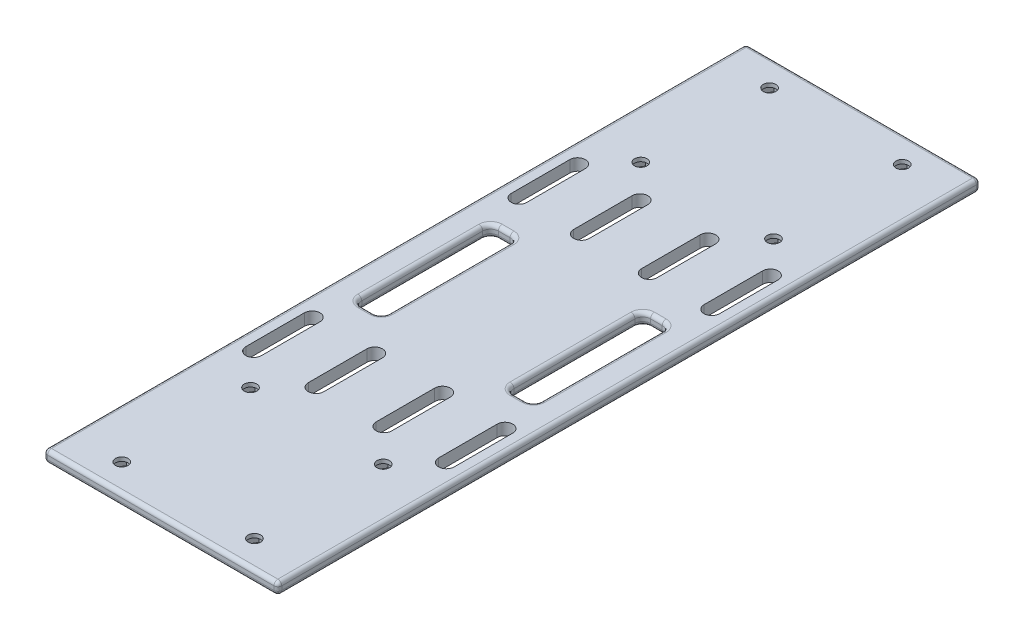
from build123d import *

# Parameters (mm, degrees)
SKETCH1_W           = 60
SKETCH1_H           = 180
SKETCH1_R           = 1.6
BOSS_EXTRUDE1_DEPTH = 3
CUT_EXTRUDE1_DEPTH  = 72
FILLET2_R           = 1
SKETCH3_R           = 1
CUT_EXTRUDE2_DEPTH  = 1
SKETCH4_R           = 1.6
CUT_EXTRUDE3_DEPTH  = 2
FILLET3_R           = 1
FILLET4_R           = 1
CUT_EXTRUDE4_DEPTH  = 10


with BuildPart() as part:
    # Sketch1 → Boss-Extrude1 (new body)
    with BuildSketch(Plane(origin=(0, 0, 0), x_dir=(1, 0, 0), z_dir=(0, 1, 0))):
        Rectangle(SKETCH1_W, SKETCH1_H)
        with Locations(Location((-17, 83, 0), (0, 0, 270))):
            Circle(SKETCH1_R, mode=Mode.SUBTRACT)
        with Locations(Location((-17, 50, 0), (0, 0, 270))):
            Circle(SKETCH1_R, mode=Mode.SUBTRACT)
        with Locations(Location((17, 50, 0), (0, 0, 90))):
            Circle(SKETCH1_R, mode=Mode.SUBTRACT)
        with Locations(Location((17, 83, 0), (0, 0, 90))):
            Circle(SKETCH1_R, mode=Mode.SUBTRACT)
        with Locations(Location((-17, -50, 0), (0, 0, 90))):
            Circle(SKETCH1_R, mode=Mode.SUBTRACT)
        with Locations(Location((17, -50, 0), (0, 0, 270))):
            Circle(SKETCH1_R, mode=Mode.SUBTRACT)
        with Locations(Location((17, -83, 0), (0, 0, 270))):
            Circle(SKETCH1_R, mode=Mode.SUBTRACT)
        with Locations(Location((-17, -83, 0), (0, 0, 90))):
            Circle(SKETCH1_R, mode=Mode.SUBTRACT)
    extrude(amount=BOSS_EXTRUDE1_DEPTH)

    # Sketch2 → Cut-Extrude1 (cut)
    with BuildSketch(Plane(origin=(0, 3, 0), x_dir=(1, 0, 0), z_dir=(0, 1, 0))):
        with BuildLine():
            Line((21, -17.5), (18, -17.5))
            ThreePointArc((18, -17.5), (16.585786438, -16.914213562), (16, -15.5))
            Line((16, -15.5), (16, 15.5))
            ThreePointArc((16, 15.5), (16.585786438, 16.914213562), (18, 17.5))
            Line((18, 17.5), (21, 17.5))
            ThreePointArc((21, 17.5), (22.414213562, 16.914213562), (23, 15.5))
            Line((23, 15.5), (23, -15.5))
            ThreePointArc((23, -15.5), (22.414213562, -16.914213562), (21, -17.5))
        make_face()
        with BuildLine():
            Line((-16, -15.5), (-16, 15.5))
            ThreePointArc((-16, 15.5), (-16.585786438, 16.914213562), (-18, 17.5))
            Line((-18, 17.5), (-21, 17.5))
            ThreePointArc((-21, 17.5), (-22.414213562, 16.914213562), (-23, 15.5))
            Line((-23, 15.5), (-23, -15.5))
            ThreePointArc((-23, -15.5), (-22.414213562, -16.914213562), (-21, -17.5))
            Line((-21, -17.5), (-18, -17.5))
            ThreePointArc((-18, -17.5), (-16.585786438, -16.914213562), (-16, -15.5))
        make_face()
    extrude(amount=-CUT_EXTRUDE1_DEPTH, mode=Mode.SUBTRACT)

    # Fillet2
    fillet2_edges = [part.edges().sort_by_distance(p)[0] for p in [
        (-30, 3, 0),
        (30, 0, 0),
    ]]
    fillet(fillet2_edges, radius=FILLET2_R)

    # Sketch3 → Cut-Extrude2 (cut)
    with BuildSketch(Plane(origin=(0, 0, 0), x_dir=(-1, 0, 0), z_dir=(0, -1, 0))):
        with Locations(Location((0, 30.47789414, 0), (0, 0, 90))):
            Circle(SKETCH3_R)
    extrude(amount=-CUT_EXTRUDE2_DEPTH, mode=Mode.SUBTRACT)

    # Sketch4 → Cut-Extrude3 (cut)
    # profile 1 of 4: a face of its own
    with BuildSketch(Plane(origin=(0, 0, 0), x_dir=(-1, 0, 0), z_dir=(0, -1, 0))):
        Polygon((15.41228676, 80.25), (18.58771324, 80.25), (20.175426481, 83), (18.58771324, 85.75), (15.41228676, 85.75), (13.824573519, 83), align=None)
        with Locations(Location((17, 83, 0), (0, 0, 90))):
            Circle(SKETCH4_R, mode=Mode.SUBTRACT)
    # profile 2 of 4: a face of its own
    with BuildSketch(Plane(origin=(0, 0, 0), x_dir=(-1, 0, 0), z_dir=(0, -1, 0))):
        Polygon((15.41228676, 47.25), (18.58771324, 47.25), (20.175426481, 50), (18.58771324, 52.75), (15.41228676, 52.75), (13.824573519, 50), align=None)
        with Locations(Location((17, 50, 0), (0, 0, 90))):
            Circle(SKETCH4_R, mode=Mode.SUBTRACT)
    # profile 3 of 4: a face of its own
    with BuildSketch(Plane(origin=(0, 0, 0), x_dir=(-1, 0, 0), z_dir=(0, -1, 0))):
        Polygon((-18.58771324, 47.25), (-15.41228676, 47.25), (-13.824573519, 50), (-15.41228676, 52.75), (-18.58771324, 52.75), (-20.175426481, 50), align=None)
        with Locations(Location((-17, 50, 0), (0, 0, 90))):
            Circle(SKETCH4_R, mode=Mode.SUBTRACT)
    # profile 4 of 4: a face of its own
    with BuildSketch(Plane(origin=(0, 0, 0), x_dir=(-1, 0, 0), z_dir=(0, -1, 0))):
        Polygon((-18.58771324, 80.25), (-15.41228676, 80.25), (-13.824573519, 83), (-15.41228676, 85.75), (-18.58771324, 85.75), (-20.175426481, 83), align=None)
        with Locations(Location((-17, 83, 0), (0, 0, 90))):
            Circle(SKETCH4_R, mode=Mode.SUBTRACT)
    cut_extrude3 = extrude(amount=-CUT_EXTRUDE3_DEPTH, mode=Mode.SUBTRACT)

    # Mirror1: Cut-Extrude3 across plane
    add(cut_extrude3.mirror(Plane.XY), mode=Mode.SUBTRACT)

    # Fillet3
    fillet3_edges = [part.edges().sort_by_distance(p)[0] for p in [
        (-0.5, 0, -90),
        (-30, 1, -90),
        (-29.707106781, 2.707106781, -90),
        (29.707106781, 0.292893219, -90),
        (0.5, 3, 90),
        (-30, 1, 90),
        (-29.707106781, 2.707106781, 90),
        (29.707106781, 0.292893219, 90),
        (30, 3, 0),
        (-0.5, 0, 90),
        (-30, 0, 0),
        (0.5, 3, -90),
        (30, 2, 90),
        (30, 2, -90),
    ]]
    fillet(fillet3_edges, radius=FILLET3_R)

    # Fillet4
    fillet4_edges = [part.edges().sort_by_distance(p)[0] for p in [
        (-23, 0, 0),
        (-22.414213562, 0, 16.914213562),
        (-19.5, 0, 17.5),
        (-16.585786438, 0, 16.914213562),
        (-16, 0, 0),
        (-16.585786438, 0, -16.914213562),
        (-19.5, 0, -17.5),
        (-22.414213562, 0, -16.914213562),
        (19.5, 0, 17.5),
        (22.414213562, 0, 16.914213562),
        (23, 0, 0),
        (22.414213562, 0, -16.914213562),
        (19.5, 0, -17.5),
        (16.585786438, 0, -16.914213562),
        (16, 0, 0),
        (16.585786438, 0, 16.914213562),
        (16.585786438, 3, 16.914213562),
        (19.5, 3, 17.5),
        (22.414213562, 3, 16.914213562),
        (23, 3, 0),
        (22.414213562, 3, -16.914213562),
        (19.5, 3, -17.5),
        (16.585786438, 3, -16.914213562),
        (16, 3, 0),
        (-22.414213562, 3, -16.914213562),
        (-23, 3, 0),
        (-22.414213562, 3, 16.914213562),
        (-19.5, 3, 17.5),
        (-16.585786438, 3, 16.914213562),
        (-16, 3, 0),
        (-16.585786438, 3, -16.914213562),
        (-19.5, 3, -17.5),
    ]]
    fillet(fillet4_edges, radius=FILLET4_R)

    # Sketch5 → Cut-Extrude4 (cut)
    with BuildSketch(Plane(origin=(0, 3, 0), x_dir=(1, 0, 0), z_dir=(0, 1, 0))):
        with BuildLine():
            Line((-22.697780221, -26.5), (-22.697780221, -41.5))
            ThreePointArc((-22.697780221, -41.5), (-24.697780221, -43.5), (-26.697780221, -41.5))
            Line((-26.697780221, -41.5), (-26.697780221, -26.5))
            ThreePointArc((-26.697780221, -26.5), (-24.697780221, -24.5), (-22.697780221, -26.5))
        make_face()
        with BuildLine():
            Line((-6.697780221, -26.5), (-6.697780221, -41.5))
            ThreePointArc((-6.697780221, -41.5), (-8.697780221, -43.5), (-10.697780221, -41.5))
            Line((-10.697780221, -41.5), (-10.697780221, -26.5))
            ThreePointArc((-10.697780221, -26.5), (-8.697780221, -24.5), (-6.697780221, -26.5))
        make_face()
        with BuildLine():
            Line((22.697780221, -26.5), (22.697780221, -41.5))
            ThreePointArc((22.697780221, -41.5), (24.697780221, -43.5), (26.697780221, -41.5))
            Line((26.697780221, -41.5), (26.697780221, -26.5))
            ThreePointArc((26.697780221, -26.5), (24.697780221, -24.5), (22.697780221, -26.5))
        make_face()
        with BuildLine():
            Line((6.697780221, -26.5), (6.697780221, -41.5))
            ThreePointArc((6.697780221, -41.5), (8.697780221, -43.5), (10.697780221, -41.5))
            Line((10.697780221, -41.5), (10.697780221, -26.5))
            ThreePointArc((10.697780221, -26.5), (8.697780221, -24.5), (6.697780221, -26.5))
        make_face()
    cut_extrude4 = extrude(amount=-CUT_EXTRUDE4_DEPTH, mode=Mode.SUBTRACT)

    # Mirror2: Cut-Extrude4 across plane
    add(cut_extrude4.mirror(Plane.XY), mode=Mode.SUBTRACT)


solid = part.part
